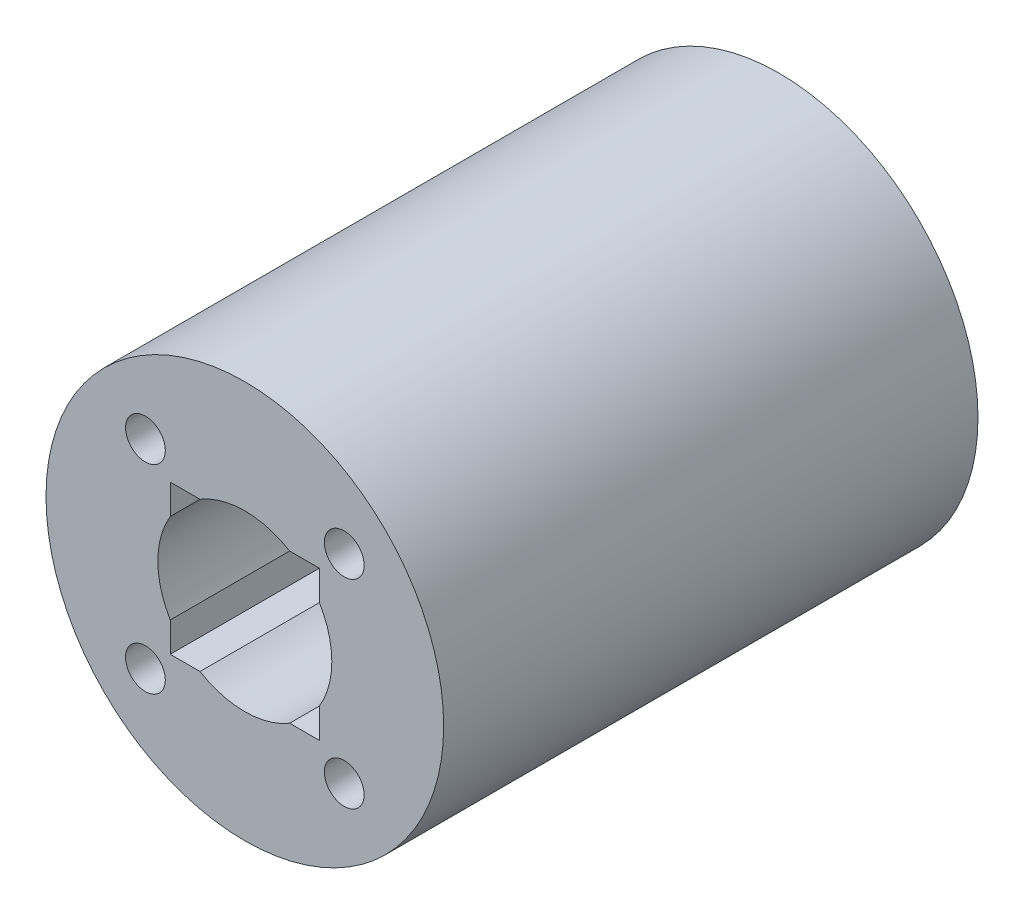
from build123d import *

# Parameters (mm, degrees)
SKETCH1_R           = 16
SKETCH1_R_2         = 1.6
BOSS_EXTRUDE1_DEPTH = 43


with BuildPart() as part:
    # Sketch1 → Boss-Extrude1 (new body)
    with BuildSketch(Plane.XY):
        Circle(SKETCH1_R)
        with Locations((-8, -8)):
            Circle(SKETCH1_R_2, mode=Mode.SUBTRACT)
        with Locations((8, -8)):
            Circle(SKETCH1_R_2, mode=Mode.SUBTRACT)
        with Locations((-8, 8)):
            Circle(SKETCH1_R_2, mode=Mode.SUBTRACT)
        with BuildLine():
            Line((-3.605551275, -6), (-6, -6))
            Line((-6, -6), (-6, -3.605551275))
            ThreePointArc((-6, -3.605551275), (-7, 0), (-6, 3.605551275))
            Line((-6, 3.605551275), (-6, 6))
            Line((-6, 6), (-3.605551275, 6))
            ThreePointArc((-3.605551275, 6), (0, 7), (3.605551275, 6))
            Line((3.605551275, 6), (6, 6))
            Line((6, 6), (6, 3.605551275))
            ThreePointArc((6, 3.605551275), (6.745368782, 1.870828693), (7, 0))
            ThreePointArc((7, 0), (6.745368782, -1.870828693), (6, -3.605551275))
            Line((6, -3.605551275), (6, -6))
            Line((6, -6), (3.605551275, -6))
            ThreePointArc((3.605551275, -6), (0, -7), (-3.605551275, -6))
        make_face(mode=Mode.SUBTRACT)
        with Locations((8, 8)):
            Circle(SKETCH1_R_2, mode=Mode.SUBTRACT)
    extrude(amount=BOSS_EXTRUDE1_DEPTH)


solid = part.part
